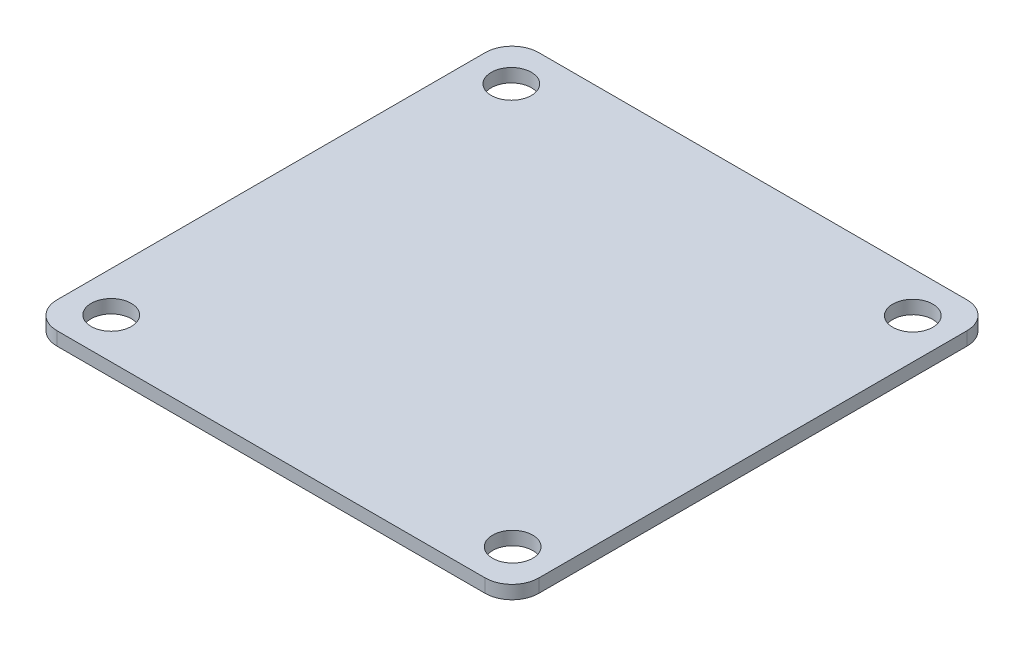
from build123d import *

# Parameters (mm, degrees)
SKETCH1_W           = 36
SKETCH1_H           = 36
SKETCH1_R           = 1.5
BOSS_EXTRUDE1_DEPTH = 1
FILLET1_R           = 2


with BuildPart() as part:
    # Sketch1 → Boss-Extrude1 (new body)
    with BuildSketch(Plane(origin=(0, 0, 0), x_dir=(1, 0, 0), z_dir=(0, 1, 0))):
        with Locations((18, 18)):
            Rectangle(SKETCH1_W, SKETCH1_H)
        with Locations(Location((3, 32.95, 0), (0, 0, 270))):
            Circle(SKETCH1_R, mode=Mode.SUBTRACT)
        with Locations(Location((33, 32.95, 0), (0, 0, 270))):
            Circle(SKETCH1_R, mode=Mode.SUBTRACT)
        with Locations(Location((3, 3.05, 0), (0, 0, 270))):
            Circle(SKETCH1_R, mode=Mode.SUBTRACT)
        with Locations(Location((33, 3.05, 0), (0, 0, 270))):
            Circle(SKETCH1_R, mode=Mode.SUBTRACT)
    extrude(amount=BOSS_EXTRUDE1_DEPTH)

    # Fillet1
    fillet1_edges = [part.edges().sort_by_distance(p)[0] for p in [
        (0, 0.5, 0),
        (36, 0.5, 0),
        (36, 0.5, -36),
        (0, 0.5, -36),
    ]]
    fillet(fillet1_edges, radius=FILLET1_R)


solid = part.part
